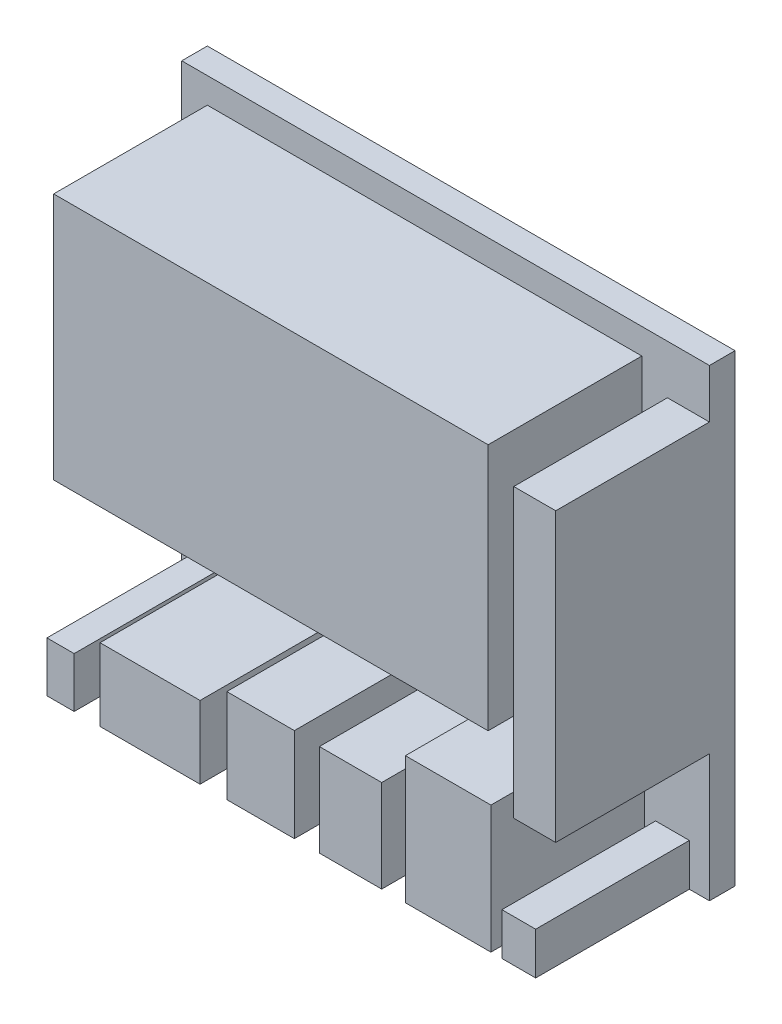
from build123d import *

# Parameters (mm, degrees)
SKETCH_1_W          = 103
SKETCH_1_H          = 90.5
EXTRUDE_1_DEPTH     = 35
CUT_EXTRUDE_1_DEPTH = 30
SKETCH_3_W          = 84.803967954
SKETCH_3_H          = 48.355269134
CUT_EXTRUDE_2_DEPTH = 30


with BuildPart() as part:
    # 草图1 → 凸台-拉伸1 (new body)
    with BuildSketch(Plane.XY):
        with Locations((51.5, 45.25)):
            Rectangle(SKETCH_1_W, SKETCH_1_H)
    extrude(amount=EXTRUDE_1_DEPTH)

    # 草图2 → 切除-拉伸1 (cut)
    with BuildSketch(Plane.XY.offset(35)):
        Polygon((0, 32.144730866), (0, 0), (3.691599488, 0), (3.691599488, 9.794798376), (9.000778853, 9.794798376), (9.000778853, 0), (14.053062443, 0), (14.053062443, 14.162026564), (33.5771414, 14.162026564), (33.5771414, 0), (38.80068884, 0), (38.80068884, 18.272358976), (51.988005329, 18.272358976), (51.988005329, 0), (56.869025068, 0), (56.869025068, 18.0154632), (69.028758454, 18.0154632), (69.028758454, 0), (73.652882417, 0), (73.652882417, 24.86601722), (90.351107841, 24.86601722), (90.351107841, 0), (92.491905972, 0), (92.491905972, 8.253423721), (99.085564217, 8.253423721), (99.085564217, 0), (103, 0), (103, 24.86601722), (94.803967954, 24.86601722), (94.803967954, 32.144730866), align=None)
    extrude(amount=-CUT_EXTRUDE_1_DEPTH, mode=Mode.SUBTRACT)

    # 草图3 → 切除-拉伸2 (cut)
    with BuildSketch(Plane.XY.offset(35)):
        Polygon((0, 90.5), (0, 32.144730866), (94.803967954, 32.144730866), (94.803967954, 80.939676354), (103, 80.939676354), (103, 90.5), align=None)
        with Locations((47.401983977, 61.322365433)):
            Rectangle(SKETCH_3_W, SKETCH_3_H, mode=Mode.SUBTRACT)
    extrude(amount=-CUT_EXTRUDE_2_DEPTH, mode=Mode.SUBTRACT)


solid = part.part
